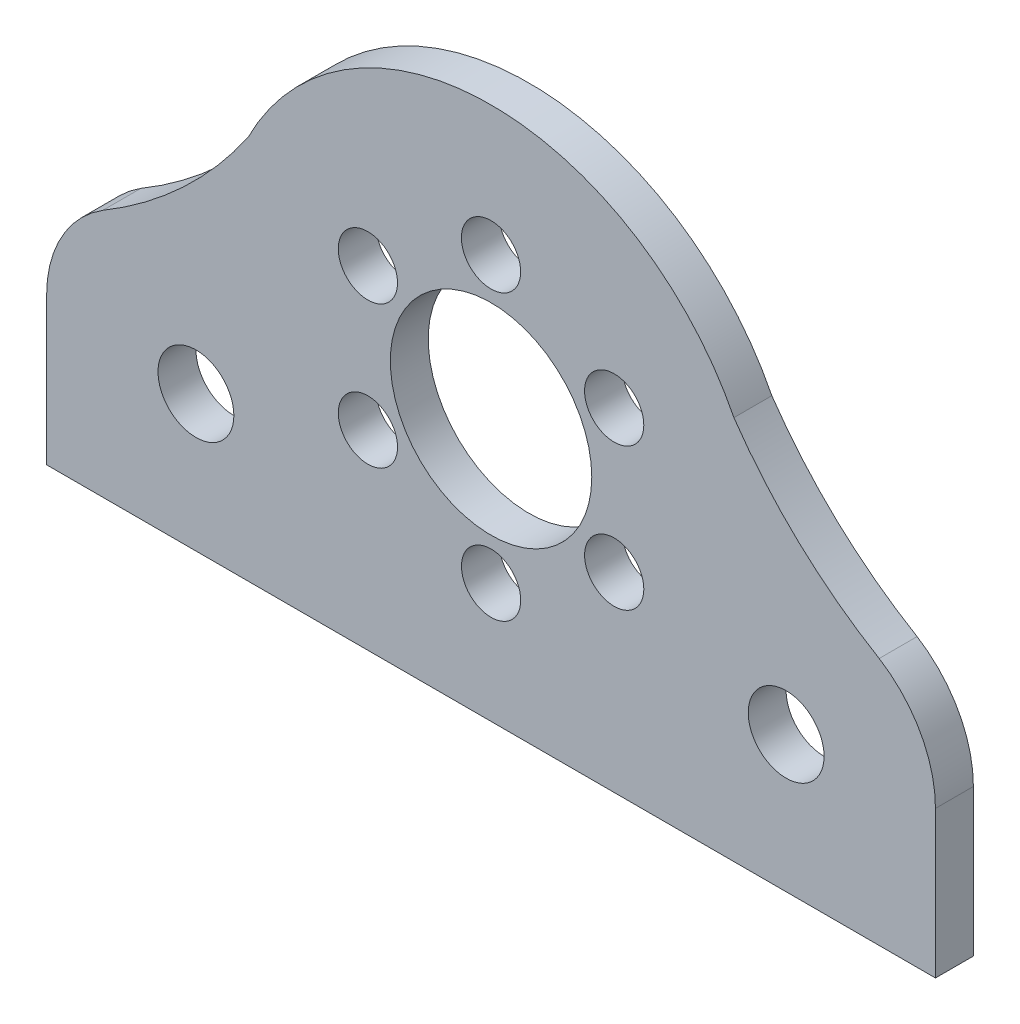
from build123d import *

# Parameters (mm, degrees)
CROQUIS1_R              = 4.25
CROQUIS1_R_2            = 1.249999997
CROQUIS1_R_3            = 1.25
CROQUIS1_R_4            = 1.250000007
CROQUIS1_R_5            = 1.6
SALIENTE_EXTRUIR1_DEPTH = 1.6


with BuildPart() as part:
    # Croquis1 → Saliente-Extruir1 (new body)
    with BuildSketch(Plane.XY):
        with BuildLine():
            Line((-18.75, -11.05), (18.75, -11.05))
            Line((18.75, -11.05), (18.75, -4.852747113))
            ThreePointArc((18.75, -4.852747113), (18.116780108, -2.400965101), (16.375506293, -0.562441789))
            ThreePointArc((16.375506293, -0.562441789), (12.997975085, 1.970224072), (10.247264226, 5.172676757))
            ThreePointArc((10.247264226, 5.172676757), (0, 11.478806947), (-10.247264226, 5.172676757))
            ThreePointArc((-10.247264226, 5.172676757), (-12.997975085, 1.970224072), (-16.375506293, -0.562441789))
            ThreePointArc((-16.375506293, -0.562441789), (-18.116780108, -2.400965101), (-18.75, -4.852747113))
            Line((-18.75, -4.852747113), (-18.75, -11.05))
        make_face()
        Circle(CROQUIS1_R, mode=Mode.SUBTRACT)
        with Locations((-0.0012, 5.99880001)):
            Circle(CROQUIS1_R_2, mode=Mode.SUBTRACT)
        with Locations((5.194513192, 3.000439231)):
            Circle(CROQUIS1_R_3, mode=Mode.SUBTRACT)
        with Locations((5.195713192, -2.998360769)):
            Circle(CROQUIS1_R_3, mode=Mode.SUBTRACT)
        with Locations((0.0012, -5.9988)):
            Circle(CROQUIS1_R_3, mode=Mode.SUBTRACT)
        with Locations((-5.194513192, -3.00043923)):
            Circle(CROQUIS1_R_3, mode=Mode.SUBTRACT)
        with Locations((-5.195713248, 2.998360802)):
            Circle(CROQUIS1_R_4, mode=Mode.SUBTRACT)
        with Locations((12.45, -5.3)):
            Circle(CROQUIS1_R_5, mode=Mode.SUBTRACT)
        with Locations((-12.45, -5.3)):
            Circle(CROQUIS1_R_5, mode=Mode.SUBTRACT)
    extrude(amount=SALIENTE_EXTRUIR1_DEPTH)


solid = part.part
